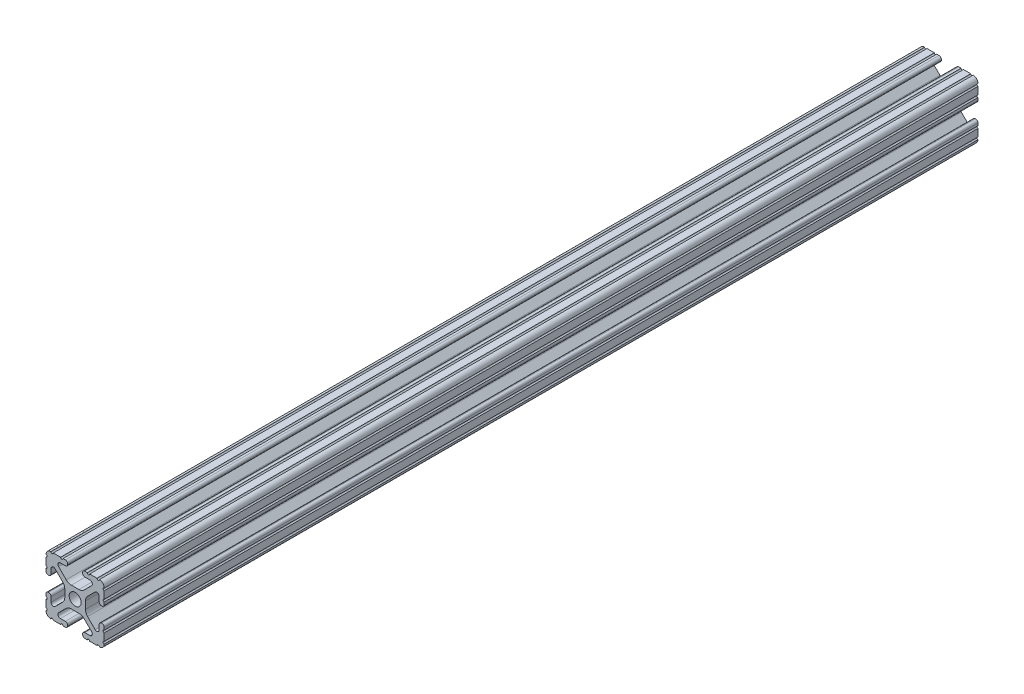
from build123d import *

# Parameters (mm, degrees)
SKETCH1_R           = 2.6035
BOSS_EXTRUDE1_DEPTH = 190.5


with BuildPart() as part:
    # Sketch1 → Boss-Extrude1 (new, symmetric)
    with BuildSketch(Plane.XY):
        with BuildLine():
            Line((-7.179650497, -8.645192506), (-3.952270251, -5.423690499))
            ThreePointArc((-3.952270251, -5.423690499), (-2.922936451, -4.736929036), (-1.709253557, -4.4958))
            Line((-1.709253557, -4.4958), (1.709253557, -4.4958))
            ThreePointArc((1.709253557, -4.4958), (2.922936451, -4.736929036), (3.952270251, -5.423690499))
            Line((3.952270251, -5.423690499), (7.179650497, -8.645192506))
            ThreePointArc((7.179650497, -8.645192506), (7.41473083, -9.822813117), (6.416408329, -10.4902))
            Line((6.416408329, -10.4902), (4.287512407, -10.4902))
            ThreePointArc((4.287512407, -10.4902), (3.54574862, -10.79744862), (3.2385, -11.539212407))
            Line((3.2385, -11.539212407), (3.2385, -11.650987593))
            ThreePointArc((3.2385, -11.650987593), (3.54574862, -12.39275138), (4.287512407, -12.7))
            Line((4.287512407, -12.7), (5.317126718, -12.7))
            ThreePointArc((5.317126718, -12.7), (5.825126718, -12.192), (6.333126718, -12.7))
            Line((6.333126718, -12.7), (9.550443118, -12.7))
            ThreePointArc((9.550443118, -12.7), (10.058366869, -12.192000006), (10.566443095, -12.699847501))
            ThreePointArc((10.566443095, -12.699847501), (12.082537762, -12.08250727), (12.699846982, -10.566399977))
            ThreePointArc((12.699846982, -10.566399977), (12.192000006, -10.058323491), (12.7, -9.5504))
            Line((12.7, -9.5504), (12.7, -6.3330836))
            ThreePointArc((12.7, -6.3330836), (12.192, -5.8250836), (12.7, -5.3170836))
            Line((12.7, -5.3170836), (12.7, -4.287469289))
            ThreePointArc((12.7, -4.287469289), (12.39275138, -3.545705502), (11.650987593, -3.238456882))
            Line((11.650987593, -3.238456882), (11.539212407, -3.238456882))
            ThreePointArc((11.539212407, -3.238456882), (10.79744862, -3.545705502), (10.4902, -4.287469289))
            Line((10.4902, -4.287469289), (10.4902, -6.402089023))
            ThreePointArc((10.4902, -6.402089023), (9.856505071, -7.351067942), (8.737131347, -7.129408934))
            Line((8.737131347, -7.129408934), (5.441005833, -3.840816462))
            ThreePointArc((5.441005833, -3.840816462), (4.750877967, -2.809883091), (4.5085, -1.593185507))
            Line((4.5085, -1.593185507), (4.5085, 1.593185507))
            ThreePointArc((4.5085, 1.593185507), (4.750877967, 2.809883091), (5.441005833, 3.840816462))
            Line((5.441005833, 3.840816462), (8.737131347, 7.129408934))
            ThreePointArc((8.737131347, 7.129408934), (9.856505071, 7.351067942), (10.4902, 6.402089023))
            Line((10.4902, 6.402089023), (10.4902, 4.287469289))
            ThreePointArc((10.4902, 4.287469289), (10.79744862, 3.545705502), (11.539212407, 3.238456882))
            Line((11.539212407, 3.238456882), (11.650987593, 3.238456882))
            ThreePointArc((11.650987593, 3.238456882), (12.39275138, 3.545705502), (12.7, 4.287469289))
            Line((12.7, 4.287469289), (12.7, 5.3170836))
            ThreePointArc((12.7, 5.3170836), (12.192, 5.8250836), (12.7, 6.3330836))
            Line((12.7, 6.3330836), (12.7, 9.5504))
            ThreePointArc((12.7, 9.5504), (12.192000006, 10.058323491), (12.699846982, 10.566399977))
            ThreePointArc((12.699846982, 10.566399977), (12.082537762, 12.08250727), (10.566443095, 12.699847501))
            ThreePointArc((10.566443095, 12.699847501), (10.058366869, 12.192000006), (9.550443118, 12.7))
            Line((9.550443118, 12.7), (6.333126718, 12.7))
            ThreePointArc((6.333126718, 12.7), (5.825126718, 12.192), (5.317126718, 12.7))
            Line((5.317126718, 12.7), (4.287512407, 12.7))
            ThreePointArc((4.287512407, 12.7), (3.54574862, 12.39275138), (3.2385, 11.650987593))
            Line((3.2385, 11.650987593), (3.2385, 11.539212407))
            ThreePointArc((3.2385, 11.539212407), (3.54574862, 10.79744862), (4.287512407, 10.4902))
            Line((4.287512407, 10.4902), (6.476788598, 10.4902))
            ThreePointArc((6.476788598, 10.4902), (7.432222385, 9.85140422), (7.207036008, 8.724370562))
            Line((7.207036008, 8.724370562), (3.898272566, 5.423169045))
            ThreePointArc((3.898272566, 5.423169045), (2.869120213, 4.736787962), (1.655778399, 4.4958))
            Line((1.655778399, 4.4958), (-1.655778399, 4.4958))
            ThreePointArc((-1.655778399, 4.4958), (-2.869120213, 4.736787962), (-3.898272566, 5.423169045))
            Line((-3.898272566, 5.423169045), (-7.207036008, 8.724370562))
            ThreePointArc((-7.207036008, 8.724370562), (-7.432222385, 9.85140422), (-6.476788598, 10.4902))
            Line((-6.476788598, 10.4902), (-4.287512407, 10.4902))
            ThreePointArc((-4.287512407, 10.4902), (-3.54574862, 10.79744862), (-3.2385, 11.539212407))
            Line((-3.2385, 11.539212407), (-3.2385, 11.650987593))
            ThreePointArc((-3.2385, 11.650987593), (-3.54574862, 12.39275138), (-4.287512407, 12.7))
            Line((-4.287512407, 12.7), (-5.317126718, 12.7))
            ThreePointArc((-5.317126718, 12.7), (-5.825126718, 12.192), (-6.333126718, 12.7))
            Line((-6.333126718, 12.7), (-9.550443118, 12.7))
            ThreePointArc((-9.550443118, 12.7), (-10.058366869, 12.192000006), (-10.566443095, 12.699847501))
            ThreePointArc((-10.566443095, 12.699847501), (-12.082537762, 12.08250727), (-12.699846982, 10.566399977))
            ThreePointArc((-12.699846982, 10.566399977), (-12.192000006, 10.058323491), (-12.7, 9.5504))
            Line((-12.7, 9.5504), (-12.7, 6.3330836))
            ThreePointArc((-12.7, 6.3330836), (-12.192, 5.8250836), (-12.7, 5.3170836))
            Line((-12.7, 5.3170836), (-12.7, 4.287469289))
            ThreePointArc((-12.7, 4.287469289), (-12.39275138, 3.545705502), (-11.650987593, 3.238456882))
            Line((-11.650987593, 3.238456882), (-11.539212407, 3.238456882))
            ThreePointArc((-11.539212407, 3.238456882), (-10.79744862, 3.545705502), (-10.4902, 4.287469289))
            Line((-10.4902, 4.287469289), (-10.4902, 6.402089023))
            ThreePointArc((-10.4902, 6.402089023), (-9.856505071, 7.351067942), (-8.737131347, 7.129408934))
            Line((-8.737131347, 7.129408934), (-5.441005833, 3.840816462))
            ThreePointArc((-5.441005833, 3.840816462), (-4.750877967, 2.809883091), (-4.5085, 1.593185507))
            Line((-4.5085, 1.593185507), (-4.5085, -1.593185507))
            ThreePointArc((-4.5085, -1.593185507), (-4.750877967, -2.809883091), (-5.441005833, -3.840816462))
            Line((-5.441005833, -3.840816462), (-8.737131347, -7.129408934))
            ThreePointArc((-8.737131347, -7.129408934), (-9.856505071, -7.351067942), (-10.4902, -6.402089023))
            Line((-10.4902, -6.402089023), (-10.4902, -4.287469289))
            ThreePointArc((-10.4902, -4.287469289), (-10.79744862, -3.545705502), (-11.539212407, -3.238456882))
            Line((-11.539212407, -3.238456882), (-11.650987593, -3.238456882))
            ThreePointArc((-11.650987593, -3.238456882), (-12.39275138, -3.545705502), (-12.7, -4.287469289))
            Line((-12.7, -4.287469289), (-12.7, -5.3170836))
            ThreePointArc((-12.7, -5.3170836), (-12.192, -5.8250836), (-12.7, -6.3330836))
            Line((-12.7, -6.3330836), (-12.7, -9.5504))
            ThreePointArc((-12.7, -9.5504), (-12.192000006, -10.058323491), (-12.699846982, -10.566399977))
            ThreePointArc((-12.699846982, -10.566399977), (-12.082537762, -12.08250727), (-10.566443095, -12.699847501))
            ThreePointArc((-10.566443095, -12.699847501), (-10.058366869, -12.192000006), (-9.550443118, -12.7))
            Line((-9.550443118, -12.7), (-6.333126718, -12.7))
            ThreePointArc((-6.333126718, -12.7), (-5.825126718, -12.192), (-5.317126718, -12.7))
            Line((-5.317126718, -12.7), (-4.287512407, -12.7))
            ThreePointArc((-4.287512407, -12.7), (-3.54574862, -12.39275138), (-3.2385, -11.650987593))
            Line((-3.2385, -11.650987593), (-3.2385, -11.539212407))
            ThreePointArc((-3.2385, -11.539212407), (-3.54574862, -10.79744862), (-4.287512407, -10.4902))
            Line((-4.287512407, -10.4902), (-6.416408329, -10.4902))
            ThreePointArc((-6.416408329, -10.4902), (-7.41473083, -9.822813117), (-7.179650497, -8.645192506))
        make_face()
        Circle(SKETCH1_R, mode=Mode.SUBTRACT)
    extrude(amount=BOSS_EXTRUDE1_DEPTH, both=True)


solid = part.part
